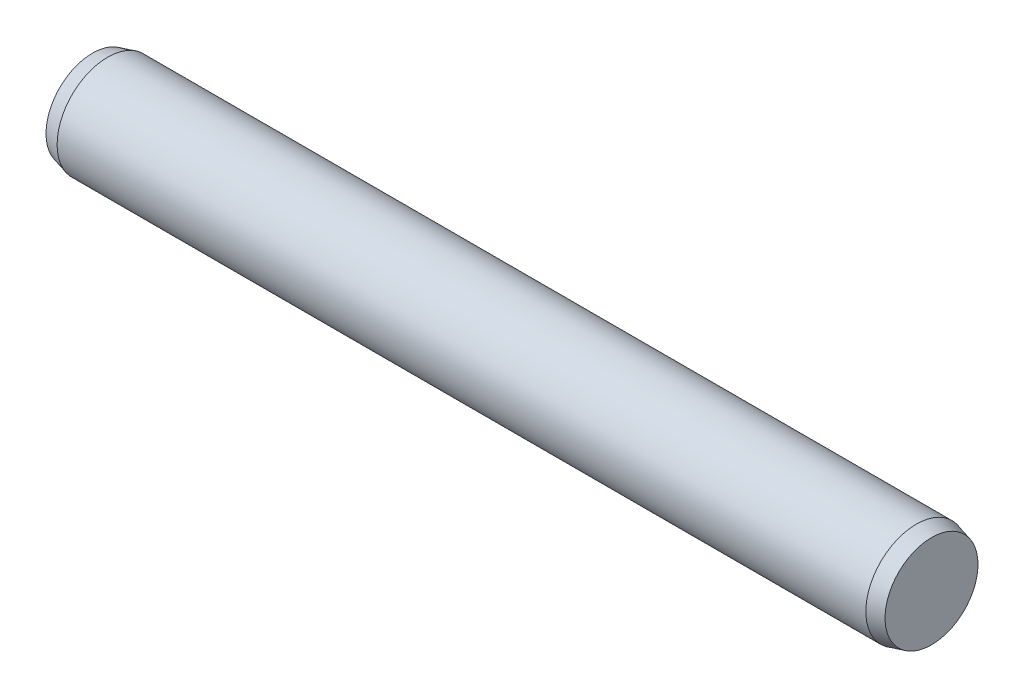
from build123d import *

# Parameters (mm, degrees)
EXTRUDE1_DEPTH      = 12
EXTRUDE1_DEPTH_BACK = 12
SKETCH2_R           = 1.5
SKETCH3_R           = 1.5
EXTRUDE2_DEPTH      = 0.45
EXTRUDE2_TAPER      = 15
SKETCH4_R           = 1.5
EXTRUDE3_DEPTH      = 0.45
EXTRUDE3_TAPER      = 15


with BuildPart() as part:
    # Sketch2 → Extrude1 (new, two sides: drawn at the far end of the back side and taken through both)
    with BuildSketch(Plane(origin=(0, 0, 0), x_dir=(0, 0, -1), z_dir=(1, 0, 0)).offset(-EXTRUDE1_DEPTH_BACK)):
        Circle(SKETCH2_R)
    extrude(amount=EXTRUDE1_DEPTH + EXTRUDE1_DEPTH_BACK)

    # Sketch3 → Extrude2 (add)
    with BuildSketch(Plane(origin=(12, 0, 0), x_dir=(0, 0, -1), z_dir=(1, 0, 0))):
        Circle(SKETCH3_R)
    extrude(amount=EXTRUDE2_DEPTH, taper=EXTRUDE2_TAPER)

    # Sketch4 → Extrude3 (add)
    with BuildSketch(Plane.ZY.offset(12)):
        with Locations(Location((0, 0, 0), (0, 0, 180))):
            Circle(SKETCH4_R)
    extrude(amount=EXTRUDE3_DEPTH, taper=EXTRUDE3_TAPER)


solid = part.part
